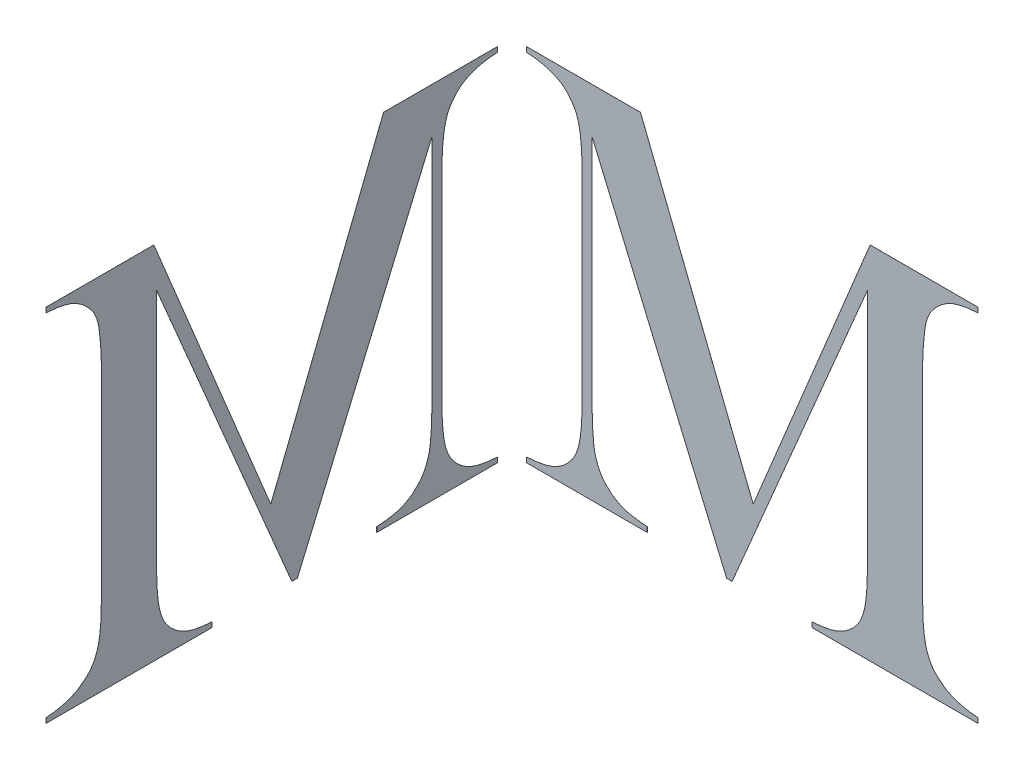
from build123d import *

# Parameters (mm, degrees)
BOSS_EXTRUDE2_DEPTH = 0.001
CIRPATTERN1_COUNT   = 2
CIRPATTERN1_ANGLE   = 270


with BuildPart() as part:
    # Sketch1 → Boss-Extrude2 (new body)
    with BuildSketch(Plane.XY):
        with BuildLine():
            add(Edge.make_bspline(
                [(23.905428759, 18.235062663), (23.783606558, 18.226980596), (23.551353442, 18.211572196), (23.220824241, 18.169569332), (22.929213753, 18.104185235), (22.667843997, 18.029753514), (22.434692563, 17.925723484), (22.213464602, 17.799137229), (22.001106251, 17.643870031), (21.872143297, 17.519646119), (21.806630834, 17.456541061)],
                knots=[0, 0, 0, 0, 1.27472696, 2.430257416, 3.474030899, 4.393079797, 5.262389402, 6.132035537, 7.051084435, 8, 8, 8, 8], degree=3))
            add(Edge.make_bspline(
                [(21.806630834, 17.456541061), (21.715282818, 17.359653837), (21.536143, 17.169651245), (21.339966667, 16.818698176), (21.21454996, 16.405782125), (21.176962263, 16.106413081), (21.156525167, 15.943640836)],
                knots=[0, 0, 0, 0, 0.94543747, 1.854068704, 2.833219195, 4, 4, 4, 4], degree=3))
            add(Edge.make_bspline(
                [(21.156525167, 15.943640836), (21.142559771, 15.820641136), (21.113455268, 15.564304328), (21.07990009, 15.161657852), (21.066879425, 14.726443684), (21.06248052, 14.425390773), (21.060213216, 14.270220693)],
                knots=[0, 0, 0, 0, 0.885669995, 1.845775404, 2.889659625, 4, 4, 4, 4], degree=3))
            Line((21.060213216, 14.270220693), (21.060213216, 4.221673838))
            add(Edge.make_bspline(
                [(21.060213216, 4.221673838), (21.063142455, 4.00363522), (21.068608266, 3.596786199), (21.091999824, 3.029822048), (21.145358174, 2.553369079), (21.207924186, 2.153460558), (21.312936212, 1.819338824), (21.440476386, 1.524655723), (21.604438734, 1.265514757), (21.740146213, 1.119115237), (21.806630834, 1.047392464)],
                knots=[0, 0, 0, 0, 1.563869192, 2.918100735, 4.06641926, 5.001642599, 5.814815472, 6.570629816, 7.299735459, 8, 8, 8, 8], degree=3))
            add(Edge.make_bspline(
                [(21.806630834, 1.047392464), (21.938581437, 0.933665091), (22.208475307, 0.701045306), (22.71357055, 0.471382928), (23.283488576, 0.310383922), (23.691525168, 0.275250001), (23.905428759, 0.256831868)],
                knots=[0, 0, 0, 0, 0.908714035, 1.858698199, 2.877472867, 4, 4, 4, 4], degree=3))
            Line((23.905428759, 0.256831868), (23.905428759, 0))
            Line((23.905428759, 0), (15.38984712, 0))
            Line((15.38984712, 0), (15.38984712, 0.256831868))
            add(Edge.make_bspline(
                [(15.38984712, 0.256831868), (15.514449549, 0.264253893), (15.751095593, 0.278349867), (16.085811157, 0.328461996), (16.38381295, 0.388890829), (16.727123476, 0.502415074), (17.12140969, 0.697855069), (17.378375997, 0.929766387), (17.508710035, 1.047392464)],
                knots=[0, 0, 0, 0, 0.96823301, 1.838876771, 2.624878089, 3.32416367, 4.642808238, 6, 6, 6, 6], degree=3))
            add(Edge.make_bspline(
                [(17.508710035, 1.047392464), (17.575371249, 1.123111524), (17.710366275, 1.276449512), (17.869702088, 1.544444649), (17.994316882, 1.840706252), (18.08870204, 2.174953994), (18.156290251, 2.568872355), (18.199674263, 3.041075336), (18.234019495, 3.601846674), (18.23469784, 4.004903994), (18.235062663, 4.221673838)],
                knots=[0, 0, 0, 0, 0.724452336, 1.467081912, 2.23025003, 3.031245717, 3.959919132, 5.101248721, 6.441011164, 8, 8, 8, 8], degree=3))
            Line((18.235062663, 4.221673838), (18.235062663, 16.409148598))
            Line((18.235062663, 16.409148598), (11.292576218, 0))
            Line((11.292576218, 0), (11.011666361, 0))
            Line((11.011666361, 0), (4.109309896, 16.164355723))
            Line((4.109309896, 16.164355723), (4.109309896, 4.221673838))
            add(Edge.make_bspline(
                [(4.109309896, 4.221673838), (4.109523254, 4.003557656), (4.10992015, 3.597810934), (4.146019648, 3.03459789), (4.183725448, 2.560841069), (4.249580475, 2.167186251), (4.352153625, 1.836447723), (4.473125484, 1.54093659), (4.635399009, 1.275946629), (4.769212693, 1.123229471), (4.835662524, 1.047392464)],
                knots=[0, 0, 0, 0, 1.567908518, 2.916673738, 4.056559418, 4.984817079, 5.778957082, 6.541783541, 7.27587199, 8, 8, 8, 8], degree=3))
            add(Edge.make_bspline(
                [(4.835662524, 1.047392464), (4.89999633, 0.984532), (5.025786689, 0.861622432), (5.233115857, 0.701801442), (5.45579597, 0.574375572), (5.692768005, 0.466673109), (5.957034448, 0.385205757), (6.253680228, 0.329894079), (6.583862512, 0.278189483), (6.816530805, 0.264176267), (6.938473447, 0.256831868)],
                knots=[0, 0, 0, 0, 0.934583141, 1.827368153, 2.712212306, 3.596072508, 4.528480631, 5.578430147, 6.730842859, 8, 8, 8, 8], degree=3))
            Line((6.938473447, 0.256831868), (6.938473447, 0))
            Line((6.938473447, 0), (0.750430616, 0))
            Line((0.750430616, 0), (0.750430616, 0.256831868))
            add(Edge.make_bspline(
                [(0.750430616, 0.256831868), (0.873703574, 0.26422415), (1.109022649, 0.278335474), (1.440680802, 0.329087756), (1.737296017, 0.385398459), (1.998976453, 0.467896822), (2.240187807, 0.569555672), (2.462278064, 0.702800726), (2.675006107, 0.859998065), (2.801153268, 0.98423584), (2.865280533, 1.047392464)],
                knots=[0, 0, 0, 0, 1.276874703, 2.437460562, 3.46881966, 4.396760133, 5.270815582, 6.170355256, 7.069894931, 8, 8, 8, 8], degree=3))
            add(Edge.make_bspline(
                [(2.865280533, 1.047392464), (2.932037202, 1.123070307), (3.067225531, 1.276324826), (3.225339745, 1.545423169), (3.356033117, 1.839642943), (3.448877559, 2.175130378), (3.51701878, 2.568809652), (3.560207854, 3.041096912), (3.594618838, 3.601839822), (3.595286878, 4.004901598), (3.595646159, 4.221673838)],
                knots=[0, 0, 0, 0, 0.724107264, 1.46638311, 2.232998284, 3.033612439, 3.961843508, 5.102629457, 6.441753743, 8, 8, 8, 8], degree=3))
            Line((3.595646159, 4.221673838), (3.595646159, 14.270220693))
            add(Edge.make_bspline(
                [(3.595646159, 14.270220693), (3.595206133, 14.473623119), (3.594351525, 14.868667035), (3.568201792, 15.262837379), (3.555516179, 15.454055087)],
                knots=[0, 0, 0, 0, 1.029771211, 2, 2, 2, 2], degree=3))
            add(Edge.make_bspline(
                [(3.555516179, 15.454055087), (3.54351967, 15.610929159), (3.521168291, 15.903210168), (3.450424295, 16.306066357), (3.371758758, 16.646520101), (3.2827545, 16.839534572), (3.24250234, 16.926825333)],
                knots=[0, 0, 0, 0, 1.245275976, 2.320144521, 3.24028565, 4, 4, 4, 4], degree=3))
            add(Edge.make_bspline(
                [(3.24250234, 16.926825333), (3.184206051, 17.029368873), (3.07042633, 17.229508124), (2.848135915, 17.487215065), (2.602172262, 17.710469146), (2.314301807, 17.88335463), (1.988456892, 18.021532679), (1.619675991, 18.128962632), (1.200726115, 18.199313782), (0.90584629, 18.22272424), (0.750430616, 18.235062663)],
                knots=[0, 0, 0, 0, 0.953346822, 1.860693686, 2.743444849, 3.633613105, 4.565536466, 5.604453865, 6.737433394, 8, 8, 8, 8], degree=3))
            Line((0.750430616, 18.235062663), (0.750430616, 18.491894531))
            Line((0.750430616, 18.491894531), (6.589342626, 18.491894531))
            Line((6.589342626, 18.491894531), (12.376085663, 3.976880964))
            Line((12.376085663, 3.976880964), (18.375517591, 18.491894531))
            Line((18.375517591, 18.491894531), (23.905428759, 18.491894531))
            Line((23.905428759, 18.491894531), (23.905428759, 18.235062663))
        make_face()
    extrude(amount=BOSS_EXTRUDE2_DEPTH)


with BuildPart() as cirpattern1_1:
    # CirPattern1: pattern copy
    add(part.part.rotate(Axis((0, -0.943005653, 0), (0, 1, 0)), 1 * CIRPATTERN1_ANGLE / (CIRPATTERN1_COUNT - 1)))


solid = Compound([part.part, cirpattern1_1.part])
